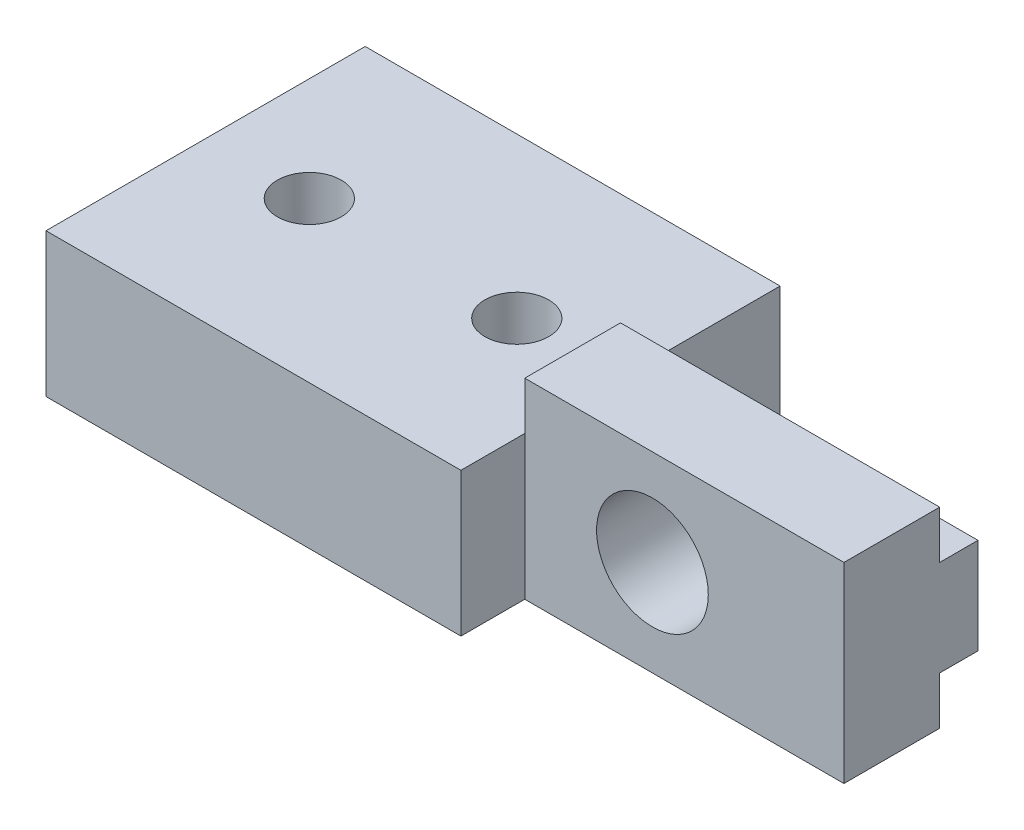
from build123d import *

# Parameters (mm, degrees)
SKETCH_2_W          = 13
SKETCH_2_H          = 10
SKETCH_2_R          = 1
EXTRUDE_1_DEPTH     = 6
EXTRUDE_3_DEPTH     = 10
SKETCH_5_R          = 1.75
CUT_EXTRUDE_1_DEPTH = 20.293781382
SKETCH_6_W          = 13
SKETCH_6_H          = 10
CUT_EXTRUDE_2_DEPTH = 1.5


with BuildPart() as part:
    # 草图2 → 凸台-拉伸1 (new body)
    with BuildSketch(Plane(origin=(0, 0, 0), x_dir=(1, 0, 0), z_dir=(0, 1, 0))):
        Rectangle(SKETCH_2_W, SKETCH_2_H)
        with Locations(Location((-3.25, 0, 0), (0, 0, 270))):
            Circle(SKETCH_2_R, mode=Mode.SUBTRACT)
        with Locations(Location((3.25, 0, 0), (0, 0, 270))):
            Circle(SKETCH_2_R, mode=Mode.SUBTRACT)
    extrude(amount=EXTRUDE_1_DEPTH)

    # 草图4 → 凸台-拉伸3 (add)
    with BuildSketch(Plane(origin=(6.5, 0, 11.5), x_dir=(0, 0, -1), z_dir=(1, 0, 0))):
        Polygon((11.5, 6), (11.5, 4.5), (12.7, 4.5), (12.7, 1.5), (11.5, 1.5), (11.5, 0), (8.5, 0), (8.5, 6), align=None)
    extrude(amount=EXTRUDE_3_DEPTH)

    # 草图5 → 切除-拉伸1 (cut, through all)
    with BuildSketch(Plane.XY.offset(3)):
        with Locations((10.5, 3)):
            Circle(SKETCH_5_R)
    extrude(amount=-CUT_EXTRUDE_1_DEPTH, mode=Mode.SUBTRACT)

    # 草图6 → 切除-拉伸2 (cut)
    with BuildSketch(Plane(origin=(0, 6, 0), x_dir=(1, 0, 0), z_dir=(0, 1, 0))):
        Rectangle(SKETCH_6_W, SKETCH_6_H)
    extrude(amount=-CUT_EXTRUDE_2_DEPTH, mode=Mode.SUBTRACT)


solid = part.part
